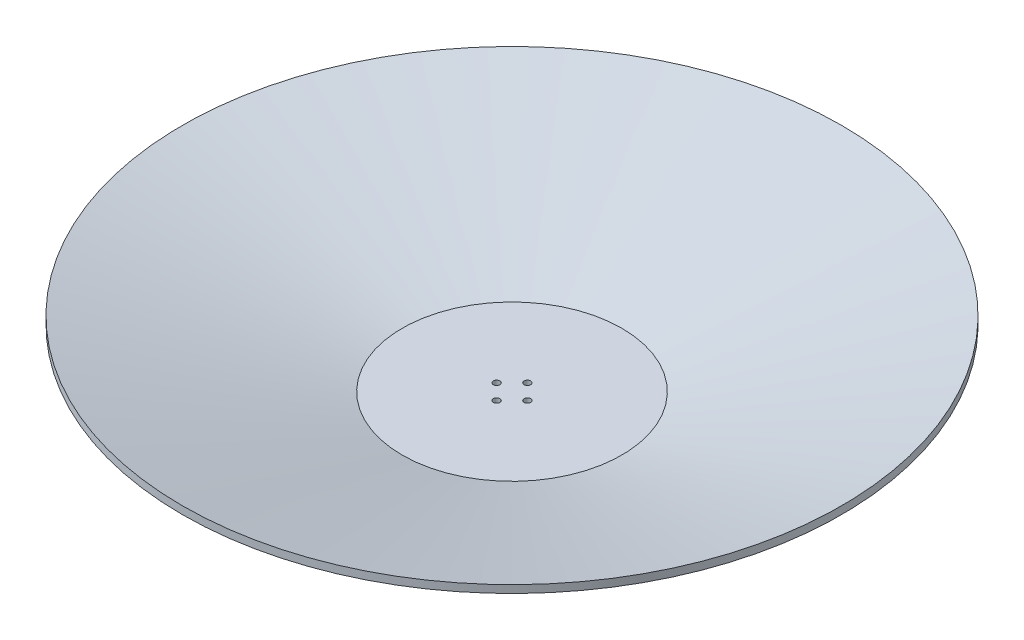
from build123d import *

# Parameters (mm, degrees)
SKETCH3_R          = 1.5
CUT_EXTRUDE1_DEPTH = 218.944947177
SKETCH4_R          = 30
CUT_EXTRUDE2_DEPTH = 15
SKETCH5_W          = 58
SKETCH5_H          = 26
CUT_EXTRUDE3_DEPTH = 216


with BuildPart() as part:
    # Sketch2 → Revolve1 (revolve)
    with BuildSketch(Plane.XY, mode=Mode.PRIVATE) as revolve1_sk:
        Polygon((0, 0), (35, 0), (43.234110893, 9.489398467), (150, 46.5), (150, 50), (50, 20), (0, 20), (0, 7.226614915), align=None)
    revolve(revolve1_sk.sketch.rotate(Axis((0, 7.226614915, 0), (0, 1, 0)), 270), axis=Axis((0, 7.226614915, 0), (0, 1, 0)))

    # Sketch3 → Cut-Extrude1 (cut, through all)
    with BuildSketch(Plane.XZ):
        with Locations(Location((0, 7, 0), (0, 0, 270))):
            Circle(SKETCH3_R)
        with Locations(Location((7, 0, 0), (0, 0, 270))):
            Circle(SKETCH3_R)
        with Locations(Location((0, -7, 0), (0, 0, 270))):
            Circle(SKETCH3_R)
        with Locations(Location((-7, 0, 0), (0, 0, 270))):
            Circle(SKETCH3_R)
    extrude(amount=-CUT_EXTRUDE1_DEPTH, mode=Mode.SUBTRACT)

    # Sketch4 → Cut-Extrude2 (cut)
    with BuildSketch(Plane.XZ):
        with Locations(Location((0, 0, 0), (0, 0, 270))):
            Circle(SKETCH4_R)
    extrude(amount=-CUT_EXTRUDE2_DEPTH, mode=Mode.SUBTRACT)

    # Sketch5 → Cut-Extrude3 (cut, through all)
    with BuildSketch(Plane.XZ.offset(-15)):
        Rectangle(SKETCH5_W, SKETCH5_H)
    extrude(amount=CUT_EXTRUDE3_DEPTH, mode=Mode.SUBTRACT)


with BuildPart() as part_1:
    # Body-Move/Copy1: moved
    add(part.part.moved(Location((0, -15, 0))))


solid = part_1.part
